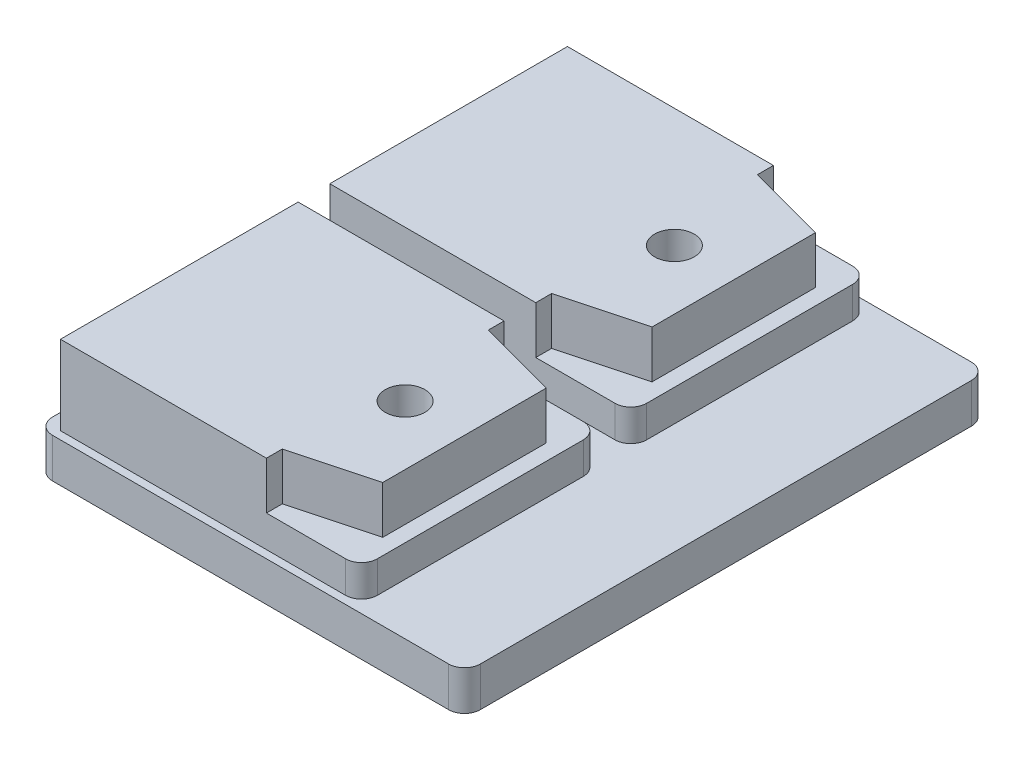
from build123d import *

# Parameters (mm, degrees)
SKETCH1_W              = 27
SKETCH1_H              = 33
EXTRUDE1_DEPTH         = 2.5
FILLET1_R              = 1
SKETCH2_W              = 19
SKETCH2_H              = 15
EXTRUDE2_DEPTH         = 5
CUT_EXTRUDE1_DEPTH     = 3
FILLET2_R              = 1
SKETCH4_R              = 1.25
CUT_EXTRUDE2_DEPTH     = 23.59977876
LPATTERN1_COUNT        = 2
LPATTERN1_PITCH        = 17
FILLET2_OF_LPATTERN1_R = 1
SKETCH5_W              = 8.254105746
SKETCH5_H              = 23.141343318
EXTRUDE3_DEPTH         = 2.5


with BuildPart() as part:
    # Sketch1 → Extrude1 (new body)
    with BuildSketch(Plane(origin=(0, 0, 0), x_dir=(1, 0, 0), z_dir=(0, 1, 0))):
        Rectangle(SKETCH1_W, SKETCH1_H)
    extrude(amount=EXTRUDE1_DEPTH)

    # Fillet1
    fillet1_edges = [part.edges().sort_by_distance(p)[0] for p in [
        (-13.5, 1.25, -16.5),
        (13.5, 1.25, -16.5),
        (13.5, 1.25, 16.5),
        (-13.5, 1.25, 16.5),
    ]]
    fillet(fillet1_edges, radius=FILLET1_R)

    # Sketch2 → Extrude2 (add)
    with BuildSketch(Plane(origin=(0, 2.5, 0), x_dir=(-1, 0, 0), z_dir=(0, 1, 0))):
        with Locations((3, 8.5)):
            Rectangle(SKETCH2_W, SKETCH2_H)
    extrude2 = extrude(amount=EXTRUDE2_DEPTH)

    # Sketch3 → Cut-Extrude1 (cut)
    with BuildSketch(Plane(origin=(0, 7.5, 0), x_dir=(-1, 0, 0), z_dir=(0, 1, 0))):
        Polygon((-0.5, 16), (-6.5, 16), (-6.5, 1), (-0.5, 1), (-0.5, 2), (-5.5, 3.339745962), (-5.5, 13.660254038), (-0.5, 15), align=None)
    cut_extrude1 = extrude(amount=-CUT_EXTRUDE1_DEPTH, mode=Mode.SUBTRACT)

    # Fillet2
    fillet2_edges = [part.edges().sort_by_distance(p)[0] for p in [
        (6.5, 3.5, 1),
        (6.5, 3.5, 16),
    ]]
    fillet(fillet2_edges, radius=FILLET2_R)

    # Sketch4 → Cut-Extrude2 (cut, through all)
    with BuildSketch(Plane(origin=(0, 7.5, 0), x_dir=(-1, 0, 0), z_dir=(0, 1, 0))):
        with Locations(Location((-1.75, 8.5, 0), (0, 0, 90))):
            Circle(SKETCH4_R)
    cut_extrude2 = extrude(amount=-CUT_EXTRUDE2_DEPTH, mode=Mode.SUBTRACT)

    # LPattern1: Extrude2, Cut-Extrude1, Cut-Extrude2 ×2
    with Locations(*[(0, 0, -i * LPATTERN1_PITCH) for i in range(1, LPATTERN1_COUNT)]):
        add(extrude2)
        add(cut_extrude1, mode=Mode.SUBTRACT)
        add(cut_extrude2, mode=Mode.SUBTRACT)

    # Fillet2 of LPattern1
    fillet2_of_lpattern1_edges = [part.edges().sort_by_distance(p)[0] for p in [
        (6.5, 3.5, -16),
        (6.5, 3.5, -1),
    ]]
    fillet(fillet2_of_lpattern1_edges, radius=FILLET2_OF_LPATTERN1_R)

    # Sketch5 → Extrude3 (add)
    with BuildSketch(Plane.XZ):
        with Locations((1.09884186, 0.082461012)):
            Rectangle(SKETCH5_W, SKETCH5_H)
    extrude(amount=-EXTRUDE3_DEPTH)


solid = part.part
